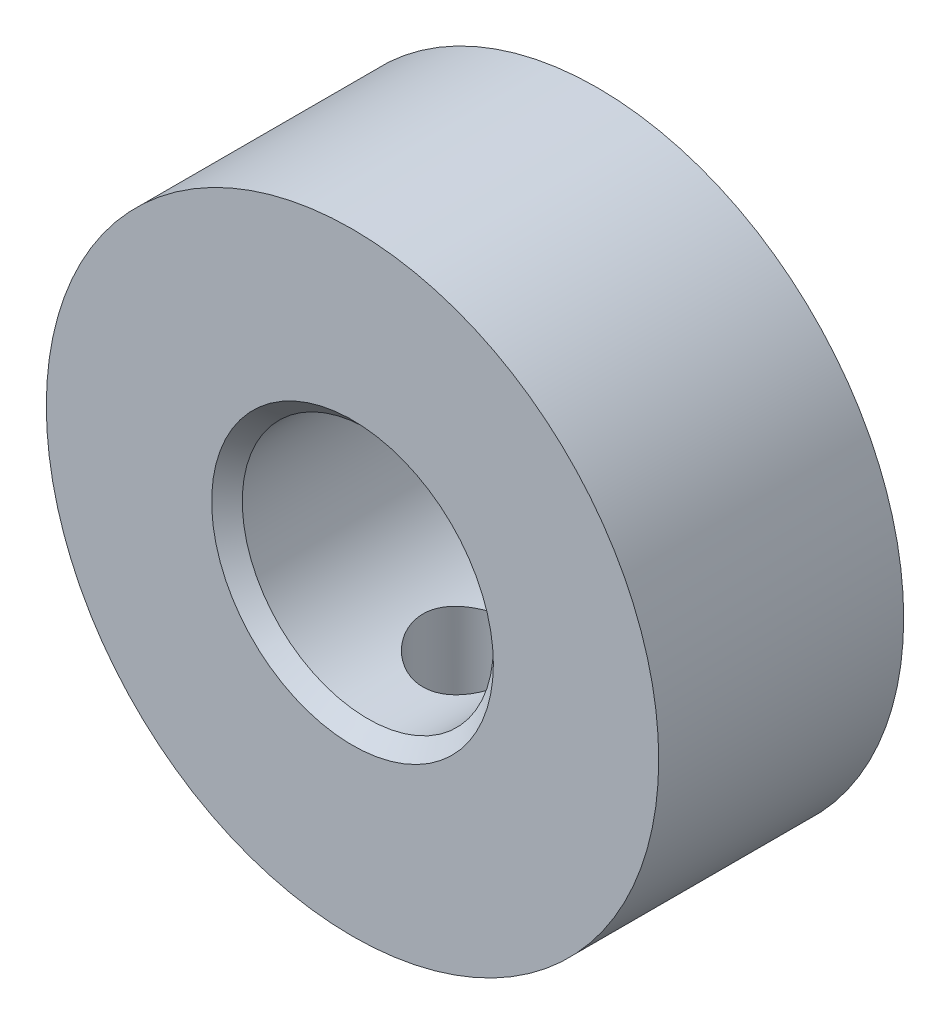
from build123d import *

# Parameters (mm, degrees)
ESQUISSE1_R             = 10
ESQUISSE1_R_2           = 4.1
BOSS_EXTRU_1_DEPTH      = 8
ESQUISSE2_R             = 1.7
ENL_V_MAT_EXTRU_1_DEPTH = 15
CHANFREIN1_SIZE         = 0.5


with BuildPart() as part:
    # Esquisse1 → Boss.-Extru.1 (new body)
    with BuildSketch(Plane.XY):
        Circle(ESQUISSE1_R)
        Circle(ESQUISSE1_R_2, mode=Mode.SUBTRACT)
    extrude(amount=BOSS_EXTRU_1_DEPTH)

    # Esquisse2 → Enlèv. mat.-Extru.1 (cut)
    with BuildSketch(Plane(origin=(0, 0, 0), x_dir=(1, 0, 0), z_dir=(0, 1, 0))):
        with Locations(Location((0, -4, 0), (0, 0, 270))):
            Circle(ESQUISSE2_R)
    extrude(amount=-ENL_V_MAT_EXTRU_1_DEPTH, mode=Mode.SUBTRACT)

    # Chanfrein1
    chanfrein1_edges = [part.edges().sort_by_distance(p)[0] for p in [
        (-4.1, 0, 0),
        (-4.1, 0, 8),
    ]]
    chamfer(chanfrein1_edges, length=CHANFREIN1_SIZE)


solid = part.part
